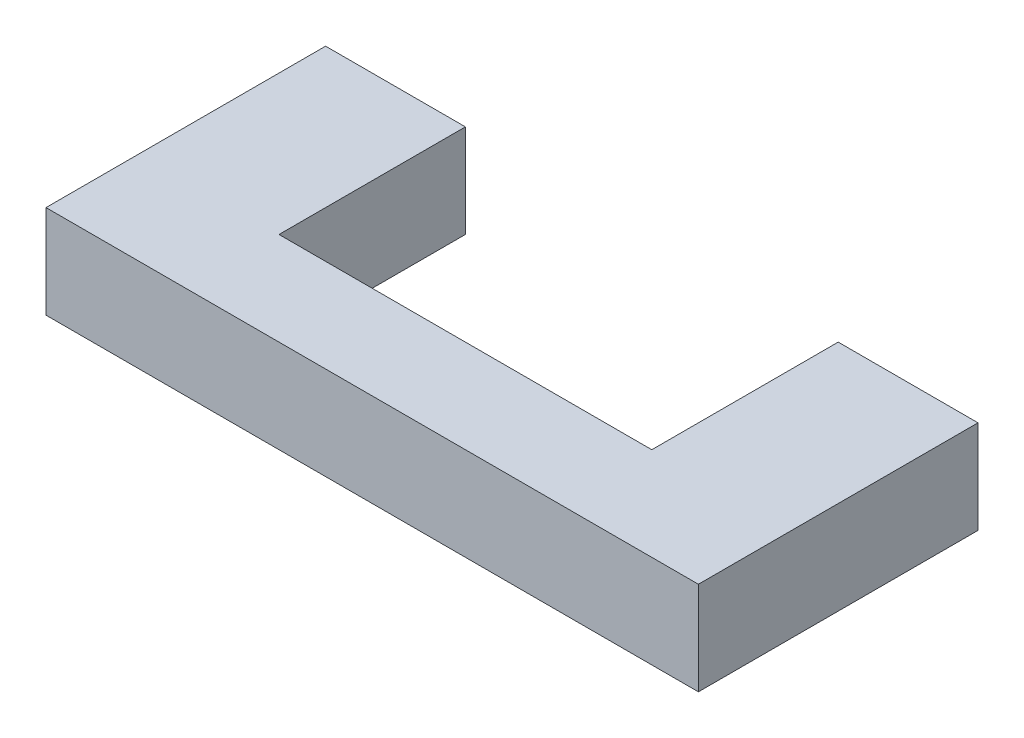
from build123d import *

# Parameters (mm, degrees)
SKETCH1_W           = 44.45
SKETCH1_H           = 19.05
BOSS_EXTRUDE1_DEPTH = 6.35
SKETCH2_W           = 25.4
SKETCH2_H           = 12.7
CUT_EXTRUDE1_DEPTH  = 6.35


with BuildPart() as part:
    # Sketch1 → Boss-Extrude1 (new body)
    with BuildSketch(Plane(origin=(0, 0, 0), x_dir=(1, 0, 0), z_dir=(0, 1, 0))):
        Rectangle(SKETCH1_W, SKETCH1_H)
    extrude(amount=BOSS_EXTRUDE1_DEPTH)

    # Sketch2 → Cut-Extrude1 (cut)
    with BuildSketch(Plane(origin=(0, 6.35, 0), x_dir=(1, 0, 0), z_dir=(0, 1, 0))):
        with Locations((0, 3.175)):
            Rectangle(SKETCH2_W, SKETCH2_H)
    extrude(amount=-CUT_EXTRUDE1_DEPTH, mode=Mode.SUBTRACT)


solid = part.part
